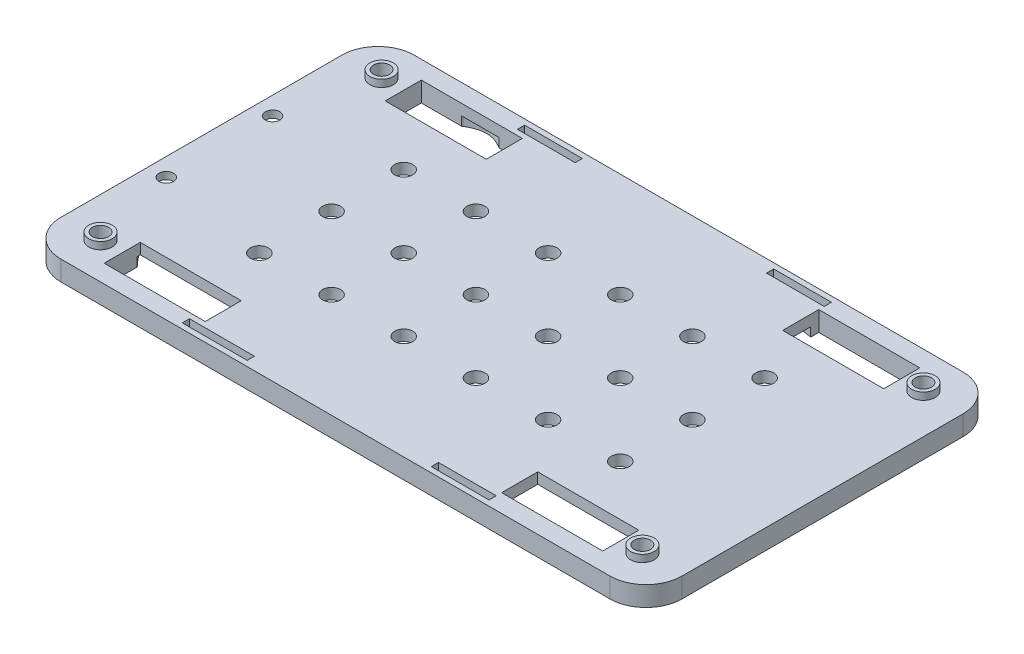
from build123d import *

# Parameters (mm, degrees)
BOSS_EXTRUDE2_DEPTH     = 6.5
CUT_EXTRUDE1_DEPTH      = 2.5
SKETCH7_W               = 15.126318285
SKETCH7_H               = 50.045217971
CUT_EXTRUDE2_DEPTH      = 2.5
SKETCH9_R               = 4.5
CUT_EXTRUDE5_DEPTH      = 1
SKETCH10_R              = 2.25
CUT_EXTRUDE6_DEPTH      = 21
SKETCH8_W               = 28
SKETCH8_H               = 10
CUT_EXTRUDE8_DEPTH      = 42
SKETCH8_3_W             = 12
SKETCH8_3_H             = 10
SKETCH8_3_R             = 3.5
CUT_EXTRUDE9_DEPTH      = 1
MIRROR2_COPY_1_SKETCH_R = 4.5
MIRROR2_COPY_1_DEPTH    = 1
MIRROR2_COPY_2_SKETCH_R = 2.25
MIRROR2_COPY_2_DEPTH    = 21
MIRROR2_COPY_3_SKETCH_W = 28
MIRROR2_COPY_3_SKETCH_H = 10
MIRROR2_COPY_3_DEPTH    = 42
MIRROR2_COPY_4_SKETCH_W = 12
MIRROR2_COPY_4_SKETCH_H = 10
MIRROR2_COPY_4_SKETCH_R = 3.5
MIRROR2_COPY_4_DEPTH    = 1
SKETCH13_W              = 122.138782423
SKETCH13_H              = 57.881417702
CUT_EXTRUDE10_DEPTH     = 1
SKETCH14_R              = 2.5
CUT_EXTRUDE11_DEPTH     = 57
SKETCH16_W              = 16
SKETCH16_H              = 2
SKETCH16_W_2            = 18
CUT_EXTRUDE12_DEPTH     = 57
SKETCH17_W              = 198.020150231
SKETCH17_H              = 122.239022266
CUT_EXTRUDE14_DEPTH     = 48.5
SKETCH23_R              = 2
CUT_EXTRUDE15_DEPTH     = 48.5
SKETCH23_3_R            = 4.25
SKETCH23_3_R_2          = 2
CUT_EXTRUDE16_DEPTH     = 1
SKETCH24_R              = 3.25
SKETCH24_R_2            = 2.25
BOSS_EXTRUDE3_DEPTH     = 2


with BuildPart() as part:
    # Sketch6 → Boss-Extrude2 (new body)
    with BuildSketch(Plane(origin=(0, 0, 0), x_dir=(1, 0, 0), z_dir=(0, 1, 0))):
        with BuildLine():
            Line((73.981646775, 59.583909473), (-78.157135648, 59.583909473))
            ThreePointArc((-78.157135648, 59.583909473), (-85.22820346, 56.654977285), (-88.157135648, 49.583909473))
            Line((-88.157135648, 49.583909473), (-88.157135648, -28.297508229))
            ThreePointArc((-88.157135648, -28.297508229), (-85.22820346, -35.368576041), (-78.157135648, -38.297508229))
            Line((-78.157135648, -38.297508229), (73.981646775, -38.297508229))
            ThreePointArc((73.981646775, -38.297508229), (81.052714587, -35.368576041), (83.981646775, -28.297508229))
            Line((83.981646775, -28.297508229), (83.981646775, 49.583909473))
            ThreePointArc((83.981646775, 49.583909473), (81.052714587, 56.654977285), (73.981646775, 59.583909473))
        make_face()
    extrude(amount=BOSS_EXTRUDE2_DEPTH)

    # Sketch1 → Cut-Extrude1 (cut)
    with BuildSketch(Plane(origin=(0, 0, 0), x_dir=(1, 0, 0), z_dir=(0, 1, 0))):
        with BuildLine():
            Line((77.806365081, -0.96565382), (-77.157134057, -0.96565382))
            Line((-77.157134057, -0.96565382), (-77.157133487, -14.112200011))
            add(Edge.make_bspline(
                [(-77.157133487, -14.112200011), (-77.156536942, -14.370123486), (-77.109197781, -14.873209632), (-76.835922488, -15.955912897), (-76.187889009, -17.500769448), (-75.043983016, -19.418277882), (-73.152039277, -22.009216703), (-70.349522729, -25.082160357), (-66.873619377, -28.097169115), (-63.686430755, -30.214139025), (-61.001852204, -31.406236435), (-58.827378352, -31.848010778), (-57.571800044, -31.879365283), (-56.919048161, -31.916770504)],
                knots=[0.000484301, 0.000484301, 0.000484301, 0.000484301, 0.031521334, 0.062558366, 0.124632431, 0.186706496, 0.248780561, 0.37292869, 0.49707682, 0.62122495, 0.745373079, 0.869521209, 0.993669339, 0.993669339, 0.993669339, 0.993669339], degree=3))
            add(Edge.make_bspline(
                [(-56.919048161, -31.916770504), (-56.676855651, -31.887329504), (-56.202107187, -31.827411173), (-55.17909933, -31.687000892), (-53.829380758, -31.487736495), (-52.075898695, -31.218386946), (-49.57440565, -30.835368063), (-46.14645809, -30.337211074), (-41.582465958, -29.781294531), (-36.59758114, -29.326101352), (-29.427370913, -28.913030471), (-19.557102597, -28.846779859), (-6.483877393, -29.587535165), (5.244808229, -30.786505775), (15.023020088, -31.929485511), (22.521025078, -32.809036887), (30.153844065, -33.641998773), (35.340846207, -34.107490241), (37.926285135, -34.298975741)],
                knots=[0.000538145, 0.000538145, 0.000538145, 0.000538145, 0.016151963, 0.031765781, 0.062993416, 0.094221052, 0.125448688, 0.18790396, 0.250359232, 0.312814503, 0.375269775, 0.500180319, 0.625090862, 0.750001406, 0.812456678, 0.874911949, 0.937367221, 0.999822493, 0.999822493, 0.999822493, 0.999822493], degree=3))
            ThreePointArc((37.926285135, -34.298975741), (38.702526051, -34.294429262), (39.475271872, -34.220710033))
            add(Edge.make_bspline(
                [(39.475271872, -34.220710033), (41.007855914, -34.057436076), (44.089984585, -33.714701696), (50.083540013, -32.842915348), (57.096899249, -31.185924421), (64.218389099, -27.883874428), (69.776327895, -23.185685517), (73.049743993, -18.278857828), (74.917700916, -14.026885359), (75.980532113, -10.773207259), (76.750872111, -7.572378035), (77.199527425, -5.064024493), (77.479780782, -3.227934), (77.653952405, -2.012317888), (77.758523252, -1.282417326), (77.806365081, -0.96565382)],
                knots=[-0.000308659, -0.000308659, -0.000308659, -0.000308659, 0.063093373, 0.126495404, 0.253299468, 0.380103532, 0.506907596, 0.633711659, 0.697113691, 0.760515723, 0.823917755, 0.887319787, 0.919020803, 0.950721818, 0.978851886, 0.978851886, 0.978851886, 0.978851886], degree=3))
        make_face()
        with BuildLine():
            Line((-77.157135648, 35.76464303), (-77.157134057, -0.96565382))
            Line((-77.157134057, -0.96565382), (77.806365081, -0.96565382))
            add(Edge.make_bspline(
                [(77.806365081, -0.96565382), (77.812438323, -0.925442533), (77.87221605, -0.53245946), (77.930059012, -0.183407073), (77.984899751, 0.147711222)],
                knots=[0.978851886, 0.978851886, 0.978851886, 0.978851886, 0.982422834, 1.01412385, 1.01412385, 1.01412385, 1.01412385], degree=3))
            add(Edge.make_bspline(
                [(77.984899751, 0.147711222), (78.028632075, 1.263321996), (78.063685274, 3.522430751), (77.942610131, 6.756968322), (77.659550444, 9.90467033), (77.073307047, 13.967118446), (75.962568899, 18.783585703), (73.443316656, 25.935742417), (69.020568834, 33.80984715), (62.049489108, 41.493231365), (53.789484117, 47.344418041), (44.612113932, 51.294661515), (34.903628635, 53.280392725), (28.311253849, 53.235690332), (25.060177828, 52.873239487)],
                knots=[0.000169226, 0.000169226, 0.000169226, 0.000169226, 0.031413574, 0.062657922, 0.09390227, 0.125146618, 0.187635314, 0.25012401, 0.375101401, 0.500078793, 0.625056185, 0.750033577, 0.875010969, 0.999988361, 0.999988361, 0.999988361, 0.999988361], degree=3))
            add(Edge.make_bspline(
                [(25.060177828, 52.873239487), (19.895446944, 51.629390577), (12.322434608, 49.13169364), (2.160698602, 45.971278142), (-3.037110446, 44.691336857), (-5.659268145, 44.190364293)],
                knots=[0.000658959, 0.000658959, 0.000658959, 0.000658959, 0.498067368, 0.746771573, 0.995475778, 0.995475778, 0.995475778, 0.995475778], degree=3))
            add(Edge.make_bspline(
                [(-5.659268145, 44.190364293), (-6.687899132, 44.046149587), (-8.728734339, 43.771857825), (-12.963271971, 43.266800577), (-18.182613839, 42.795189919), (-23.901458121, 42.63215561), (-28.830638135, 42.989857068), (-32.966568973, 43.951399156), (-35.917714049, 45.291439085), (-38.19591431, 46.677930402), (-39.939161114, 47.865789175), (-41.506959745, 48.979842665), (-42.863802202, 49.929184347), (-43.616290768, 50.440510486), (-43.98532936, 50.688555671)],
                knots=[-0.00019559, -0.00019559, -0.00019559, -0.00019559, 0.062587211, 0.125370012, 0.250935613, 0.376501215, 0.502066816, 0.627632417, 0.753198019, 0.81598082, 0.87876362, 0.941546421, 0.972937821, 1.004329222, 1.004329222, 1.004329222, 1.004329222], degree=3))
            add(Edge.make_bspline(
                [(-43.98532936, 50.688555671), (-44.244485854, 50.867312015), (-44.768150418, 51.232519494), (-45.750657054, 51.933111662), (-46.891239492, 52.75905139), (-48.145972585, 53.649626958), (-49.697116091, 54.681113287), (-51.460780236, 55.648746777), (-53.407719169, 56.259273829), (-55.251731489, 56.357375065), (-56.710973324, 56.08081223), (-57.794758617, 55.713765742), (-58.546542767, 55.391458897), (-59.229896481, 55.042763399), (-59.583745645, 54.835934013), (-59.770155285, 54.723823826)],
                knots=[-0.002497219, -0.002497219, -0.002497219, -0.002497219, 0.029065652, 0.060628523, 0.123754265, 0.186880007, 0.250005749, 0.376257234, 0.502508718, 0.628760202, 0.755011687, 0.818137429, 0.881263171, 0.944388913, 1.007514655, 1.007514655, 1.007514655, 1.007514655], degree=3))
            add(Edge.make_bspline(
                [(-59.770155285, 54.723823826), (-60.193626174, 54.476092852), (-61.03864602, 53.961192652), (-62.636768194, 52.907176262), (-65.258656407, 50.976312285), (-68.51709364, 48.049765778), (-71.244275363, 45.065662035), (-73.189921829, 42.724657875), (-74.069794154, 41.617885903), (-74.515784144, 41.052117052)],
                knots=[0.000174078, 0.000174078, 0.000174078, 0.000174078, 0.062881444, 0.12558881, 0.251003541, 0.501833004, 0.752662466, 0.878077198, 1.003491929, 1.003491929, 1.003491929, 1.003491929], degree=3))
            add(Edge.make_bspline(
                [(-74.515784144, 41.052117052), (-75.065753244, 40.22169422), (-76.07645723, 38.477870595), (-76.833603448, 36.687528936), (-77.157135648, 35.76464303)],
                knots=[0.499549048, 0.499549048, 0.499549048, 0.499549048, 0.499765799, 0.49998255, 0.49998255, 0.49998255, 0.49998255], degree=3))
        make_face()
    extrude(amount=CUT_EXTRUDE1_DEPTH, mode=Mode.SUBTRACT)

    # Sketch7 → Cut-Extrude2 (cut)
    with BuildSketch(Plane.XZ):
        with Locations((-83.782077592, -10.91040897)):
            Rectangle(SKETCH7_W, SKETCH7_H)
    extrude(amount=-CUT_EXTRUDE2_DEPTH, mode=Mode.SUBTRACT)

    # Sketch9 → Cut-Extrude5 (cut)
    with BuildSketch(Plane.XZ):
        with Locations(Location((72.981646775, -49.583909473, 0), (0, 0, 270))):
            Circle(SKETCH9_R)
    cut_extrude5 = extrude(amount=-CUT_EXTRUDE5_DEPTH, mode=Mode.SUBTRACT)

    # Sketch10 → Cut-Extrude6 (cut)
    with BuildSketch(Plane.XZ.offset(-1)):
        with Locations(Location((72.981646775, -49.583909473, 0), (0, 0, 270))):
            Circle(SKETCH10_R)
    cut_extrude6 = extrude(amount=-CUT_EXTRUDE6_DEPTH, mode=Mode.SUBTRACT)

    # Sketch8 → Cut-Extrude8 (cut)
    with BuildSketch(Plane(origin=(0, 6.5, 0), x_dir=(1, 0, 0), z_dir=(0, 1, 0))):
        with Locations((52.981646775, 49.583909473)):
            Rectangle(SKETCH8_W, SKETCH8_H)
    cut_extrude8 = extrude(amount=-CUT_EXTRUDE8_DEPTH, mode=Mode.SUBTRACT)

    # Sketch8<3> → Cut-Extrude9 (cut)
    with BuildSketch(Plane(origin=(0, 6.5, 0), x_dir=(1, 0, 0), z_dir=(0, 1, 0))):
        with Locations((72.981646775, 49.583909473)):
            Rectangle(SKETCH8_3_W, SKETCH8_3_H)
        with Locations(Location((72.981646775, 49.583909473, 0), (0, 0, 270))):
            Circle(SKETCH8_3_R, mode=Mode.SUBTRACT)
    cut_extrude9 = extrude(amount=-CUT_EXTRUDE9_DEPTH, mode=Mode.SUBTRACT)

    # Mirror1: Cut-Extrude5, Cut-Extrude6, Cut-Extrude8, Cut-Extrude9 across plane
    add(cut_extrude5.mirror(Plane.XY.offset(-10.643200622)), mode=Mode.SUBTRACT)
    add(cut_extrude6.mirror(Plane.XY.offset(-10.643200622)), mode=Mode.SUBTRACT)
    add(cut_extrude8.mirror(Plane.XY.offset(-10.643200622)), mode=Mode.SUBTRACT)
    add(cut_extrude9.mirror(Plane.XY.offset(-10.643200622)), mode=Mode.SUBTRACT)

    # Mirror2: Cut-Extrude5, Cut-Extrude6, Cut-Extrude8, Cut-Extrude9 across plane
    add(cut_extrude5.mirror(Plane.ZY.offset(2.087744437)), mode=Mode.SUBTRACT)
    add(cut_extrude6.mirror(Plane.ZY.offset(2.087744437)), mode=Mode.SUBTRACT)
    add(cut_extrude8.mirror(Plane.ZY.offset(2.087744437)), mode=Mode.SUBTRACT)
    add(cut_extrude9.mirror(Plane.ZY.offset(2.087744437)), mode=Mode.SUBTRACT)

    # Mirror2 copy 1 sketch → Mirror2 copy 1 (cut)
    with BuildSketch(Plane(origin=(-4.175488873, 0, -21.286401244), x_dir=(-1, 0, 0), z_dir=(0, -1, 0))):
        with Locations(Location((72.981646775, -49.583909473, 0), (0, 0, 270))):
            Circle(MIRROR2_COPY_1_SKETCH_R)
    extrude(amount=-MIRROR2_COPY_1_DEPTH, mode=Mode.SUBTRACT)

    # Mirror2 copy 2 sketch → Mirror2 copy 2 (cut)
    with BuildSketch(Plane(origin=(-4.175488873, 1, -21.286401244), x_dir=(-1, 0, 0), z_dir=(0, -1, 0))):
        with Locations(Location((72.981646775, -49.583909473, 0), (0, 0, 270))):
            Circle(MIRROR2_COPY_2_SKETCH_R)
    extrude(amount=-MIRROR2_COPY_2_DEPTH, mode=Mode.SUBTRACT)

    # Mirror2 copy 3 sketch → Mirror2 copy 3 (cut)
    with BuildSketch(Plane(origin=(-4.175488873, 6.5, -21.286401244), x_dir=(-1, 0, 0), z_dir=(0, 1, 0))):
        with Locations((52.981646775, 49.583909473)):
            Rectangle(MIRROR2_COPY_3_SKETCH_W, MIRROR2_COPY_3_SKETCH_H)
    extrude(amount=-MIRROR2_COPY_3_DEPTH, mode=Mode.SUBTRACT)

    # Mirror2 copy 4 sketch → Mirror2 copy 4 (cut)
    with BuildSketch(Plane(origin=(-4.175488873, 6.5, -21.286401244), x_dir=(-1, 0, 0), z_dir=(0, 1, 0))):
        with Locations((72.981646775, 49.583909473)):
            Rectangle(MIRROR2_COPY_4_SKETCH_W, MIRROR2_COPY_4_SKETCH_H)
        with Locations(Location((72.981646775, 49.583909473, 0), (0, 0, 270))):
            Circle(MIRROR2_COPY_4_SKETCH_R, mode=Mode.SUBTRACT)
    extrude(amount=-MIRROR2_COPY_4_DEPTH, mode=Mode.SUBTRACT)

    # Sketch13 → Cut-Extrude10 (cut)
    with BuildSketch(Plane(origin=(0, 6.5, 0), x_dir=(1, 0, 0), z_dir=(0, 1, 0))):
        with Locations((-2.087744436, 10.643200622)):
            Rectangle(SKETCH13_W, SKETCH13_H)
    extrude(amount=-CUT_EXTRUDE10_DEPTH, mode=Mode.SUBTRACT)

    # Sketch14 → Cut-Extrude11 (cut)
    with BuildSketch(Plane(origin=(0, 5.5, 0), x_dir=(1, 0, 0), z_dir=(0, 1, 0))):
        with Locations(Location((-52.087744437, 30.643200622, 0), (0, 0, 270))):
            Circle(SKETCH14_R)
        with Locations(Location((7.912255563, 30.643200622, 0), (0, 0, 270))):
            Circle(SKETCH14_R)
        with Locations(Location((27.912255563, 30.643200622, 0), (0, 0, 270))):
            Circle(SKETCH14_R)
        with Locations(Location((47.912255563, 30.643200622, 0), (0, 0, 270))):
            Circle(SKETCH14_R)
        with Locations(Location((47.912255563, 10.643200622, 0), (0, 0, 270))):
            Circle(SKETCH14_R)
        with Locations(Location((7.912255563, 10.643200622, 0), (0, 0, 270))):
            Circle(SKETCH14_R)
        with Locations(Location((-12.087744437, 10.643200622, 0), (0, 0, 270))):
            Circle(SKETCH14_R)
        with Locations(Location((-32.087744437, 10.643200622, 0), (0, 0, 270))):
            Circle(SKETCH14_R)
        with Locations(Location((-52.087744437, 10.643200622, 0), (0, 0, 270))):
            Circle(SKETCH14_R)
        with Locations(Location((47.912255563, -9.356799378, 0), (0, 0, 270))):
            Circle(SKETCH14_R)
        with Locations(Location((27.912255563, -9.356799378, 0), (0, 0, 270))):
            Circle(SKETCH14_R)
        with Locations(Location((7.912255563, -9.356799378, 0), (0, 0, 270))):
            Circle(SKETCH14_R)
        with Locations(Location((-12.087744437, -9.356799378, 0), (0, 0, 270))):
            Circle(SKETCH14_R)
        with Locations(Location((-32.087744437, -9.356799378, 0), (0, 0, 270))):
            Circle(SKETCH14_R)
        with Locations(Location((-52.087744437, -9.356799378, 0), (0, 0, 270))):
            Circle(SKETCH14_R)
        with Locations(Location((-32.087744437, 30.643200622, 0), (0, 0, 270))):
            Circle(SKETCH14_R)
        with Locations(Location((-12.087744437, 30.643200622, 0), (0, 0, 270))):
            Circle(SKETCH14_R)
        with Locations(Location((27.912255563, 10.643200622, 0), (0, 0, 270))):
            Circle(SKETCH14_R)
    extrude(amount=-CUT_EXTRUDE11_DEPTH, mode=Mode.SUBTRACT)

    # Sketch16 → Cut-Extrude12 (cut)
    with BuildSketch(Plane.XZ):
        with Locations((30.981646775, -57.083909473)):
            Rectangle(SKETCH16_W, SKETCH16_H)
        with Locations((30.981646775, 35.797508229)):
            Rectangle(SKETCH16_W, SKETCH16_H)
        with Locations((-38.018353225, -57.083909473)):
            Rectangle(SKETCH16_W, SKETCH16_H)
        with Locations((-37.018353225, 35.797508229)):
            Rectangle(SKETCH16_W_2, SKETCH16_H)
    extrude(amount=-CUT_EXTRUDE12_DEPTH, mode=Mode.SUBTRACT)

    # Sketch17 → Cut-Extrude14 (cut)
    with BuildSketch(Plane(origin=(0, 5.5, 0), x_dir=(1, 0, 0), z_dir=(0, 1, 0))):
        with Locations((-0.586253557, 7.90518784)):
            Rectangle(SKETCH17_W, SKETCH17_H)
    extrude(amount=CUT_EXTRUDE14_DEPTH, mode=Mode.SUBTRACT)

    # Sketch23 → Cut-Extrude15 (cut)
    with BuildSketch(Plane.XZ.offset(-2.5)):
        with Locations(Location((-83.157135648, 4.08959103, 0), (0, 0, 270))):
            Circle(SKETCH23_R)
    cut_extrude15 = extrude(amount=-CUT_EXTRUDE15_DEPTH, mode=Mode.SUBTRACT)

    # Sketch23<3> → Cut-Extrude16 (cut)
    with BuildSketch(Plane.XZ.offset(-2.5)):
        with Locations(Location((-83.157135648, 4.08959103, 0), (0, 0, 270))):
            Circle(SKETCH23_3_R)
        with Locations(Location((-83.157135648, 4.08959103, 0), (0, 0, 270))):
            Circle(SKETCH23_3_R_2, mode=Mode.SUBTRACT)
    cut_extrude16 = extrude(amount=-CUT_EXTRUDE16_DEPTH, mode=Mode.SUBTRACT)

    # Mirror4: Cut-Extrude15, Cut-Extrude16 across plane
    add(cut_extrude15.mirror(Plane.XY.offset(-10.643200622)), mode=Mode.SUBTRACT)
    add(cut_extrude16.mirror(Plane.XY.offset(-10.643200622)), mode=Mode.SUBTRACT)

    # Sketch24 → Boss-Extrude3 (add)
    # profile 1 of 4: a face of its own
    with BuildSketch(Plane(origin=(0, 5.5, 0), x_dir=(1, 0, 0), z_dir=(0, 1, 0))):
        with Locations(Location((-77.157135648, 49.583909473, 0), (0, 0, 270))):
            Circle(SKETCH24_R)
        with Locations(Location((-77.157135648, 49.583909473, 0), (0, 0, 90))):
            Circle(SKETCH24_R_2, mode=Mode.SUBTRACT)
    # profile 2 of 4: a face of its own
    with BuildSketch(Plane(origin=(0, 5.5, 0), x_dir=(1, 0, 0), z_dir=(0, 1, 0))):
        with Locations(Location((72.981646775, 49.583909473, 0), (0, 0, 270))):
            Circle(SKETCH24_R)
        with Locations(Location((72.981646775, 49.583909473, 0), (0, 0, 90))):
            Circle(SKETCH24_R_2, mode=Mode.SUBTRACT)
    # profile 3 of 4: a face of its own
    with BuildSketch(Plane(origin=(0, 5.5, 0), x_dir=(1, 0, 0), z_dir=(0, 1, 0))):
        with Locations(Location((-77.157135648, -28.297508229, 0), (0, 0, 270))):
            Circle(SKETCH24_R)
        with Locations(Location((-77.157135648, -28.297508229, 0), (0, 0, 270))):
            Circle(SKETCH24_R_2, mode=Mode.SUBTRACT)
    # profile 4 of 4: a face of its own
    with BuildSketch(Plane(origin=(0, 5.5, 0), x_dir=(1, 0, 0), z_dir=(0, 1, 0))):
        with Locations(Location((72.981646775, -28.297508229, 0), (0, 0, 270))):
            Circle(SKETCH24_R)
        with Locations(Location((72.981646775, -28.297508229, 0), (0, 0, 270))):
            Circle(SKETCH24_R_2, mode=Mode.SUBTRACT)
    extrude(amount=BOSS_EXTRUDE3_DEPTH)


solid = part.part
